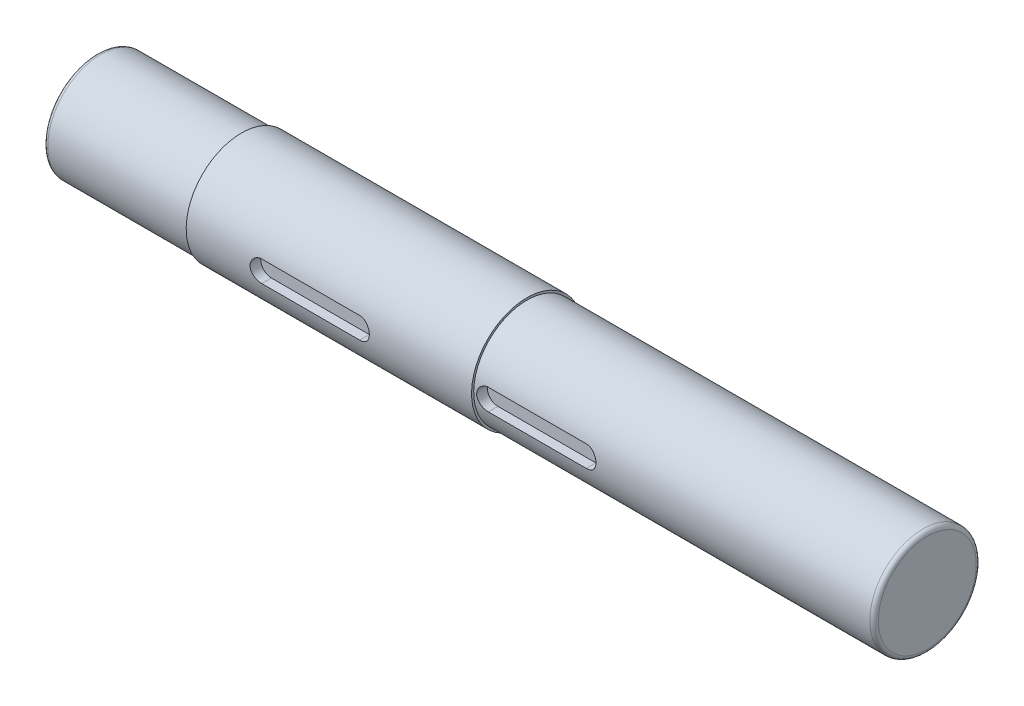
from build123d import *

# Parameters (mm, degrees)
CUT_EXTRUDE2_DEPTH = 2.5
CUT_EXTRUDE3_DEPTH = 2.5
FILLET1_R          = 1
FILLET2_R          = 1


with BuildPart() as part:
    # Sketch1 → Revolve1 (revolve)
    with BuildSketch(Plane.XY, mode=Mode.PRIVATE) as revolve1_sk:
        Polygon((16.777055999, 0), (16.777055999, 12.5), (50.777055999, 12.5), (50.777055999, 13), (117.777055999, 13), (117.777055999, 12.5), (211.777055999, 12.5), (211.777055999, 0), align=None)
    revolve(revolve1_sk.sketch.rotate(Axis((0, 0, 0), (1, 0, 0)), 180), axis=Axis((0, 0, 0), (1, 0, 0)))

    # Sketch2 → Cut-Extrude2 (cut)
    with BuildSketch(Plane.XY.offset(12.5)):
        with BuildLine():
            Line((120.977055999, 2.5), (143.977055999, 2.5))
            ThreePointArc((143.977055999, 2.5), (146.477055999, 0), (143.977055999, -2.5))
            Line((143.977055999, -2.5), (120.977055999, -2.5))
            ThreePointArc((120.977055999, -2.5), (118.477055999, 0), (120.977055999, 2.5))
        make_face()
    extrude(amount=-CUT_EXTRUDE2_DEPTH, mode=Mode.SUBTRACT)

    # Sketch3 → Cut-Extrude3 (cut)
    with BuildSketch(Plane.XY.offset(13)):
        with BuildLine():
            Line((68.277055999, 2.5), (91.277055999, 2.5))
            ThreePointArc((91.277055999, 2.5), (93.777055999, 0), (91.277055999, -2.5))
            Line((91.277055999, -2.5), (68.277055999, -2.5))
            ThreePointArc((68.277055999, -2.5), (65.777055999, 0), (68.277055999, 2.5))
        make_face()
    extrude(amount=-CUT_EXTRUDE3_DEPTH, mode=Mode.SUBTRACT)

    # Fillet1
    fillet1_edges = [part.edges().sort_by_distance(p)[0] for p in [
        (211.777055999, 12.5, 0),
    ]]
    fillet(fillet1_edges, radius=FILLET1_R)

    # Fillet2
    fillet2_edges = [part.edges().sort_by_distance(p)[0] for p in [
        (16.777055999, 12.5, 0),
    ]]
    fillet(fillet2_edges, radius=FILLET2_R)


solid = part.part
